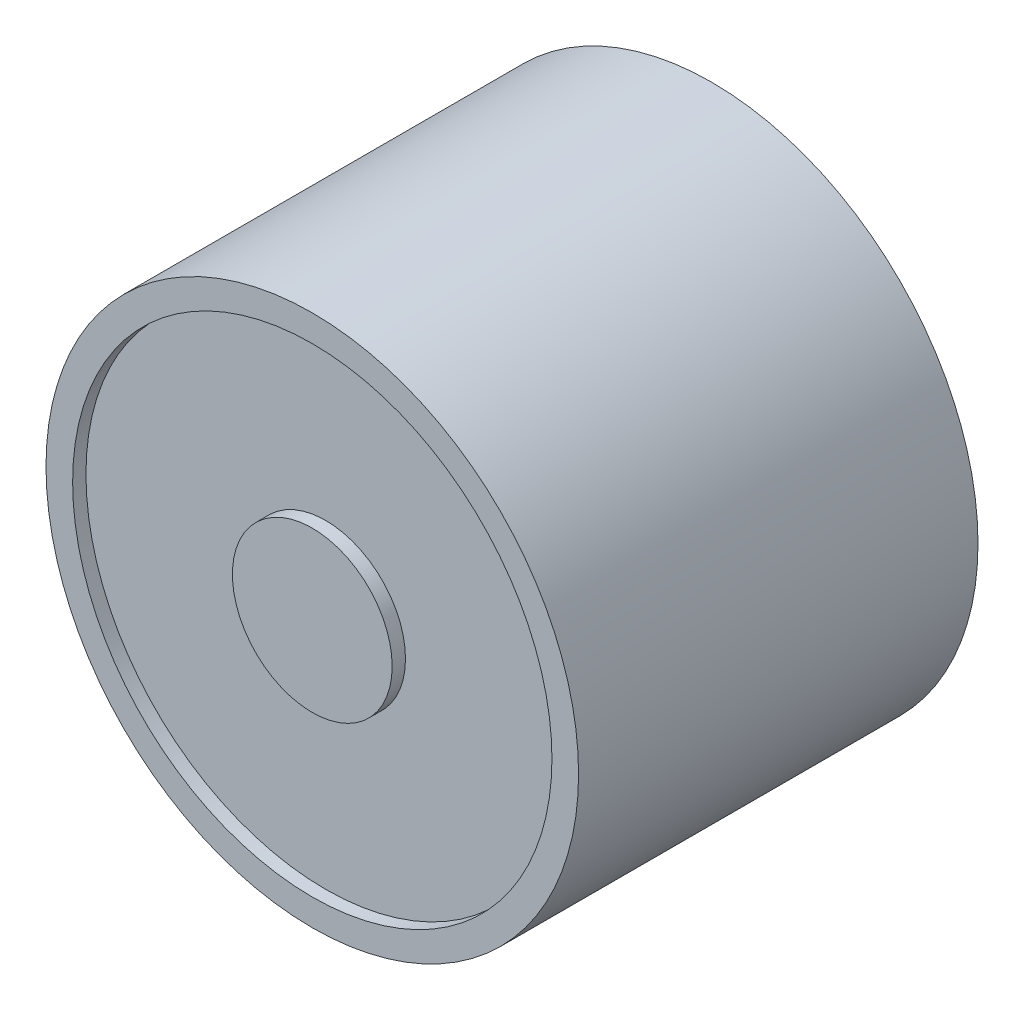
from build123d import *

# Parameters (mm, degrees)
SKETCH1_R           = 10
BOSS_EXTRUDE1_DEPTH = 15
SKETCH2_R           = 9
SKETCH2_R_2         = 3
CUT_EXTRUDE1_DEPTH  = 0.5
SKETCH3_R           = 2
CUT_EXTRUDE2_DEPTH  = 3


with BuildPart() as part:
    # Sketch1 → Boss-Extrude1 (new body)
    with BuildSketch(Plane.XY):
        Circle(SKETCH1_R)
    extrude(amount=BOSS_EXTRUDE1_DEPTH)

    # Sketch2 → Cut-Extrude1 (cut)
    with BuildSketch(Plane.XY.offset(15)):
        Circle(SKETCH2_R)
        Circle(SKETCH2_R_2, mode=Mode.SUBTRACT)
    extrude(amount=-CUT_EXTRUDE1_DEPTH, mode=Mode.SUBTRACT)

    # Sketch3 → Cut-Extrude2 (cut)
    with BuildSketch(Plane(origin=(0, 0, 0), x_dir=(-1, 0, 0), z_dir=(0, 0, -1))):
        Circle(SKETCH3_R)
    extrude(amount=-CUT_EXTRUDE2_DEPTH, mode=Mode.SUBTRACT)


solid = part.part
